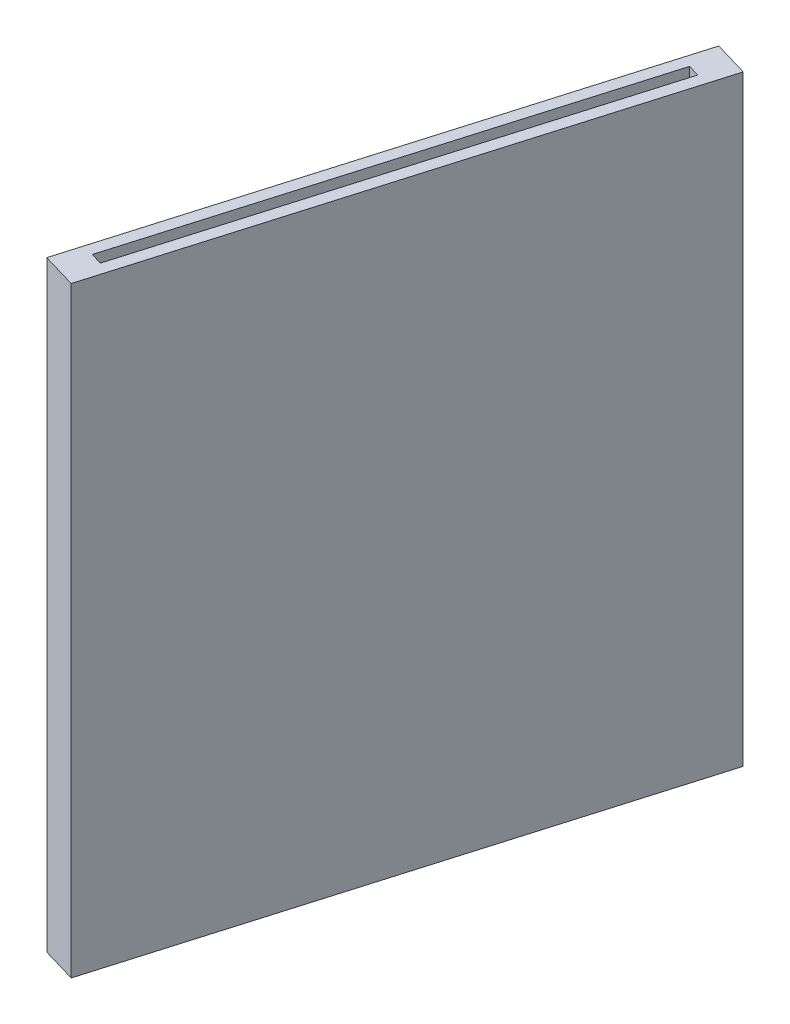
from build123d import *

# Parameters (mm, degrees)
BOSS_EXTRUDE1_DEPTH = 127


with BuildPart() as part:
    # Sketch5 → Boss-Extrude1 (new body)
    with BuildSketch(Plane(origin=(0, 0, 0), x_dir=(1, 0, 0), z_dir=(0, 1, 0))):
        Polygon((-35.906793393, -108.580423135), (-28.596428271, -110.730530524), (3.655182561, -1.075053694), (-3.655182561, 1.075053694), align=None)
        Polygon((-3.010150344, -5.733619704), (-0.57336197, -6.450322166), (-29.241460488, -103.921857126), (-31.678248862, -103.205154663), align=None, mode=Mode.SUBTRACT)
    extrude(amount=-BOSS_EXTRUDE1_DEPTH)


solid = part.part
